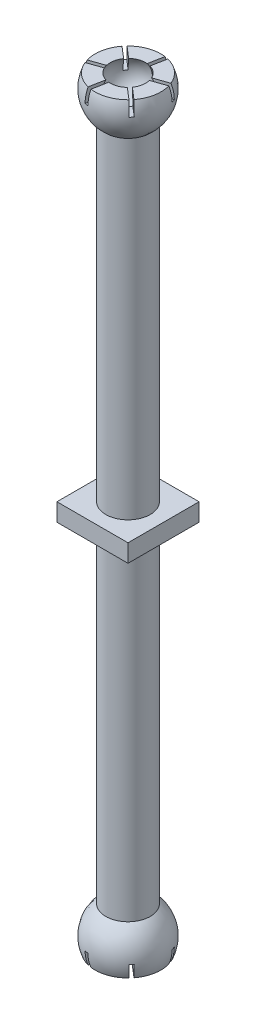
from build123d import *

# Parameters (mm, degrees)
CROQUIS1_R              = 25
SALIENTE_EXTRUIR1_DEPTH = 413
CROQUIS4_R              = 68.578914383
CORTAR_EXTRUIR1_DEPTH   = 883.814249998
CROQUIS5_R              = 66.280834566
CORTAR_EXTRUIR3_DEPTH   = 883.814249998
CORTAR_EXTRUIR5_DEPTH   = 868.845608389
CROQUIS10_W             = 80
CROQUIS10_H             = 80
SALIENTE_EXTRUIR2_DEPTH = 10


with BuildPart() as part:
    # Croquis1 → Saliente-Extruir1 (new, symmetric)
    with BuildSketch(Plane(origin=(0, 0, 0), x_dir=(1, 0, 0), z_dir=(0, 1, 0))):
        with Locations(Location((0, 0, 0), (0, 0, 90))):
            Circle(CROQUIS1_R)
    extrude(amount=SALIENTE_EXTRUIR1_DEPTH, both=True)

    # Croquis2 → Revolución1 (revolve)
    with BuildSketch(Plane.XZ.offset(413)):
        with BuildLine():
            Line((0, 40), (0, -40))
            ThreePointArc((0, -40), (-40, 0), (0, 40))
        make_face()
    revolve(axis=Axis((0, -413, 0), (0, 0, 1)))

    # Croquis3 → Revolución2 (revolve)
    with BuildSketch(Plane(origin=(0, 413, 0), x_dir=(1, 0, 0), z_dir=(0, 1, 0))):
        with BuildLine():
            Line((0, 40), (0, -40))
            ThreePointArc((0, -40), (-40, 0), (0, 40))
        make_face()
    revolve(axis=Axis((0, 413, 0), (0, 0, -1)))

    # Croquis4 → Cortar-Extruir1 (cut, through all)
    with BuildSketch(Plane(origin=(0, -428, 0), x_dir=(-1, 0, 0), z_dir=(0, -1, 0))):
        Circle(CROQUIS4_R)
    extrude(amount=CORTAR_EXTRUIR1_DEPTH, mode=Mode.SUBTRACT)

    # Croquis5 → Cortar-Extruir3 (cut, through all)
    with BuildSketch(Plane(origin=(0, 428, 0), x_dir=(1, 0, 0), z_dir=(0, 1, 0))):
        Circle(CROQUIS5_R)
    extrude(amount=CORTAR_EXTRUIR3_DEPTH, mode=Mode.SUBTRACT)

    # Croquis8 → Cortar-Revolución1 (revolve, cut)
    with BuildSketch(Plane(origin=(0, -413, 0), x_dir=(-1, 0, 0), z_dir=(0, -1, 0))):
        with BuildLine():
            ThreePointArc((0, -25), (-25, 0), (0, 25))
            Line((0, 25), (0, -25))
        make_face()
    cortar_revoluci_n1 = revolve(axis=Axis((0, -413, 0), (0, 0, -1)), mode=Mode.SUBTRACT)

    # Croquis9 → Cortar-Extruir5 (cut, through all)
    with BuildSketch(Plane.XZ.offset(413)):
        with BuildLine():
            Line((2.609481879, -3.03160095), (39.411783919, -15.904756782))
            ThreePointArc((39.411783919, -15.904756782), (40.11657953, -14.032464033), (40.732486417, -12.129078709))
            Line((40.732486417, -12.129078709), (3.930184377, 0.744077123))
            Line((3.930184377, 0.744077123), (33.479815374, 26.179227692))
            ThreePointArc((33.479815374, 26.179227692), (32.210760095, 27.725744969), (30.870333494, 29.210828642))
            Line((30.870333494, 29.210828642), (1.320702497, 3.775678073))
            Line((1.320702497, 3.775678073), (-5.931968546, 42.083984474))
            ThreePointArc((-5.931968546, 42.083984474), (-7.905819434, 41.758209002), (-9.862152922, 41.33990735))
            Line((-9.862152922, 41.33990735), (-2.609481879, 3.03160095))
            Line((-2.609481879, 3.03160095), (-39.411783919, 15.904756782))
            ThreePointArc((-39.411783919, 15.904756782), (-40.11657953, 14.032464033), (-40.732486417, 12.129078709))
            Line((-40.732486417, 12.129078709), (-3.930184377, -0.744077123))
            Line((-3.930184377, -0.744077123), (-33.479815374, -26.179227692))
            ThreePointArc((-33.479815374, -26.179227692), (-32.210760095, -27.725744969), (-30.870333494, -29.210828642))
            Line((-30.870333494, -29.210828642), (-1.320702497, -3.775678073))
            Line((-1.320702497, -3.775678073), (5.931968546, -42.083984474))
            ThreePointArc((5.931968546, -42.083984474), (7.905819434, -41.758209002), (9.862152922, -41.33990735))
            Line((9.862152922, -41.33990735), (2.609481879, -3.03160095))
        make_face()
    cortar_extruir5 = extrude(amount=CORTAR_EXTRUIR5_DEPTH, mode=Mode.SUBTRACT)

    # Simetría1: Cortar-Revolución1, Cortar-Extruir5 across plane
    add(cortar_revoluci_n1.mirror(Plane.ZX), mode=Mode.SUBTRACT)
    add(cortar_extruir5.mirror(Plane.ZX), mode=Mode.SUBTRACT)

    # Croquis10 → Saliente-Extruir2 (add, symmetric)
    with BuildSketch(Plane(origin=(0, 0, 0), x_dir=(1, 0, 0), z_dir=(0, 1, 0))):
        Rectangle(CROQUIS10_W, CROQUIS10_H)
    extrude(amount=SALIENTE_EXTRUIR2_DEPTH, both=True)


solid = part.part
